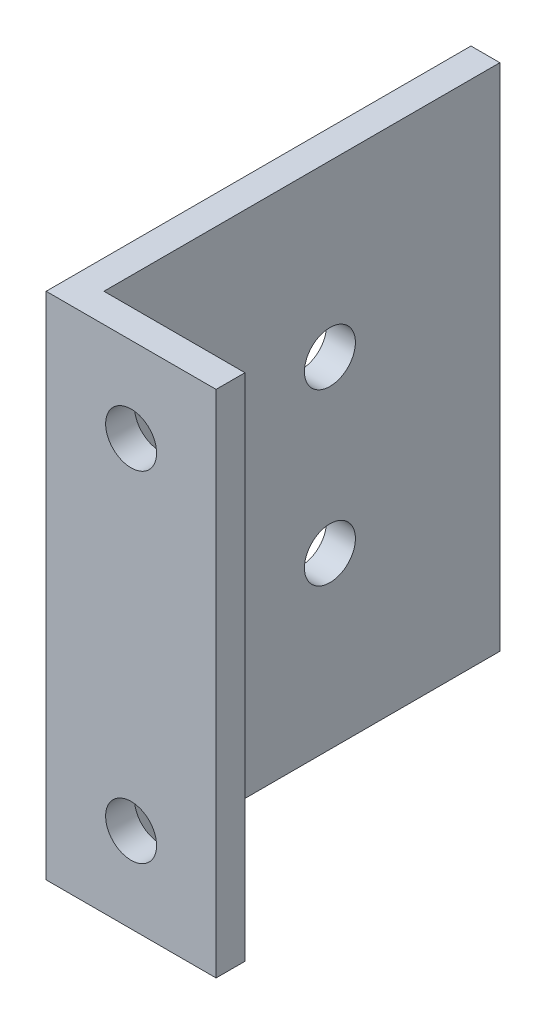
from build123d import *

# Parameters (mm, degrees)
EXTRUDE_THIN1_DEPTH = 30
SKETCH10_R          = 1.5
CUT_EXTRUDE1_DEPTH  = 10
SKETCH11_R          = 1.5
CUT_EXTRUDE2_DEPTH  = 10
SKETCH12_W          = 15
SKETCH12_H          = 1.7
CUT_EXTRUDE3_DEPTH  = 40


with BuildPart() as part:
    # Sketch9 → Extrude-Thin1 (new body)
    with BuildSketch(Plane(origin=(0, 0, 0), x_dir=(1, 0, 0), z_dir=(0, 1, 0))):
        Polygon((0, 25), (0, 0), (25, 0), (25, 1.7), (1.7, 1.7), (1.7, 25), align=None)
    extrude(amount=EXTRUDE_THIN1_DEPTH)

    # Sketch10 → Cut-Extrude1 (cut)
    with BuildSketch(Plane.XY):
        with Locations((5, 25)):
            Circle(SKETCH10_R)
        with Locations((5, 5)):
            Circle(SKETCH10_R)
    extrude(amount=-CUT_EXTRUDE1_DEPTH, mode=Mode.SUBTRACT)

    # Sketch11 → Cut-Extrude2 (cut)
    with BuildSketch(Plane.ZY):
        with Locations((-15, 10)):
            Circle(SKETCH11_R)
        with Locations((-15, 20)):
            Circle(SKETCH11_R)
    extrude(amount=-CUT_EXTRUDE2_DEPTH, mode=Mode.SUBTRACT)

    # Sketch12 → Cut-Extrude3 (cut)
    with BuildSketch(Plane(origin=(0, 30, 0), x_dir=(1, 0, 0), z_dir=(0, 1, 0))):
        with Locations((17.5, 0.85)):
            Rectangle(SKETCH12_W, SKETCH12_H)
    extrude(amount=-CUT_EXTRUDE3_DEPTH, mode=Mode.SUBTRACT)


solid = part.part
